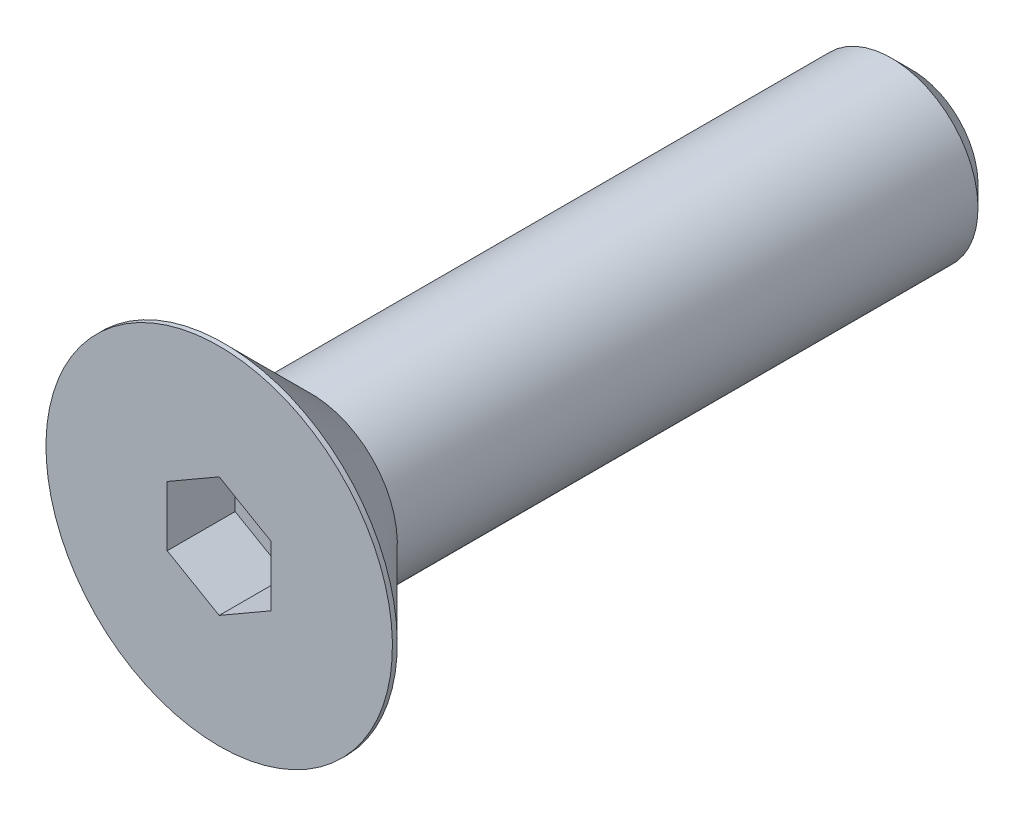
from build123d import *

# Parameters (mm, degrees)
CHAMFER1_SIZE      = 0.6
CUT_EXTRUDE2_DEPTH = 1.96


with BuildPart() as part:
    # Sketch1 → Revolve1 (revolve)
    with BuildSketch(Plane(origin=(0, 0, 0), x_dir=(0, 0, -1), z_dir=(1, 0, 0))):
        Polygon((-7.2, 2.5), (10, 2.5), (10, 0), (-8.04, 0), (-8.04, 2.5), align=None)
    revolve(axis=Axis((0, 0, 8.04), (0, 0, -1)))

    # Chamfer1
    chamfer1_edges = [part.edges().sort_by_distance(p)[0] for p in [
        (0, -2.5, -10),
    ]]
    chamfer(chamfer1_edges, length=CHAMFER1_SIZE)


with BuildPart() as body_2:
    # Sketch7 → Revolve2 (revolve)
    with BuildSketch(Plane(origin=(0, 0, 0), x_dir=(0, 0, -1), z_dir=(1, 0, 0))):
        Polygon((-9.86, 5), (-10, 5), (-10, 0), (-7.2, 0), (-7.2, 2.34), align=None)
    revolve(axis=Axis((0, 0, 10), (0, 0, -1)))

    # Sketch5 → Cut-Extrude2 (cut)
    with BuildSketch(Plane.XY.offset(10)):
        Polygon((1.5, -0.866025404), (1.5, 0.866025404), (0, 1.732050808), (-1.5, 0.866025404), (-1.5, -0.866025404), (0, -1.732050808), align=None)
    extrude(amount=-CUT_EXTRUDE2_DEPTH, mode=Mode.SUBTRACT)


solid = Compound([part.part, body_2.part])
